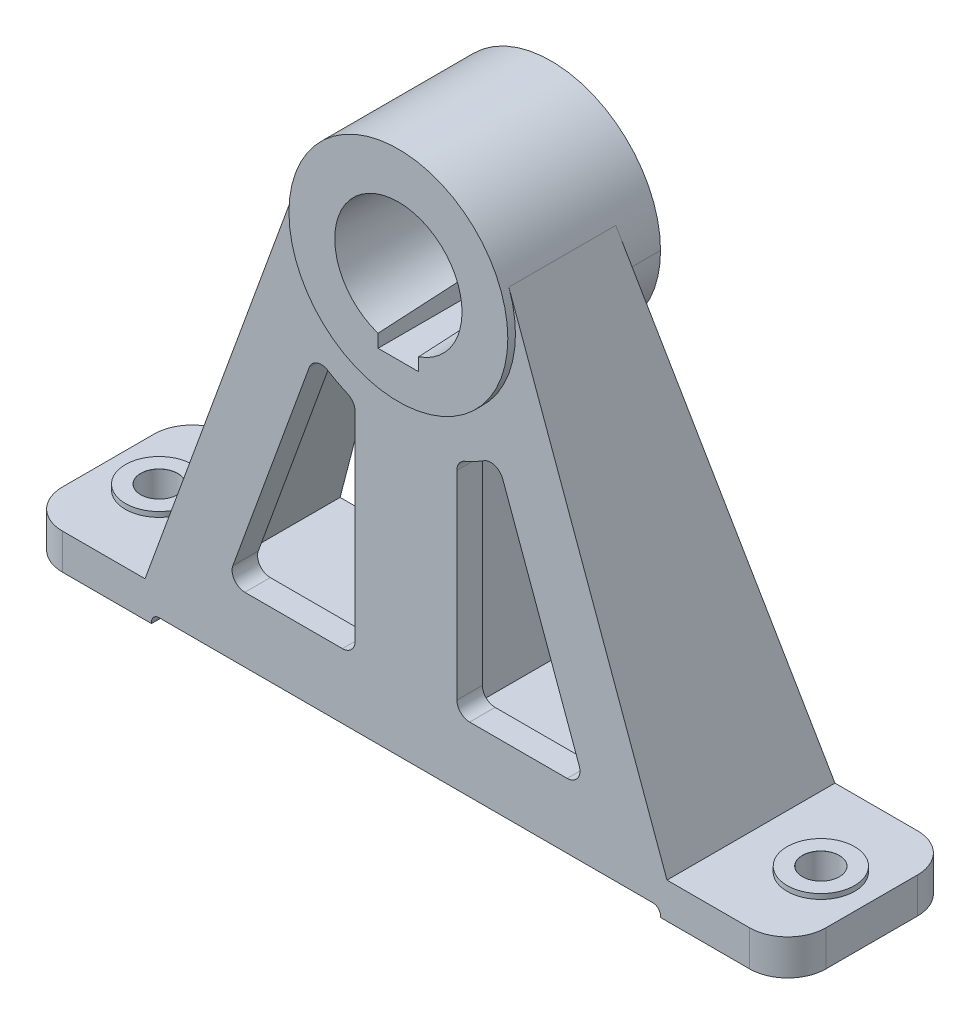
from build123d import *

# Parameters (mm, degrees)
EXTRUDE_1_DEPTH                     = 14
CUT_EXTRUDE_1_DEPTH                 = 165.474922101
CUT_EXTRUDE_1_DEPTH_BACK            = 165.474922101
SKETCH_3_W                          = 200
SKETCH_3_H                          = 3.5
FILLET_1_R                          = 3
EXTRUDE_START                       = 69
SKETCH_7_R                          = 43
EXTRUDE_2_DEPTH                     = 60
EXTRUDE_3_REACH                     = 270.747
CUT_EXTRUDE_START                   = -56
CUT_EXTRUDE_1_2_DEPTH               = 56
RIB_1_REACH                         = 264.992
SKETCH_11_WALL_W                    = 641.342631142
SKETCH_11_WALL_H                    = 10
CUT_EXTRUDE_2_DEPTH                 = 267.467634057
SKETCH_13_R                         = 25
CUT_EXTRUDE_3_DEPTH                 = 270.499536178
CUT_EXTRUDE_3_DRAFT                 = -3
CUT_EXTRUDE_2_2_DEPTH               = 270.499536178
CUT_EXTRUDE_2_2_DEPTH_BACK          = 270.499536178
SKETCH_14_W                         = 16
SKETCH_14_H                         = 28.8
SKETCH_16_R                         = 13.25
EXTRUDE_4_DEPTH                     = 2
HOLE_WIZARD_14_5_14_5_1_D           = 14.5
HOLE_WIZARD_14_5_14_5_1_CSINK_D     = 14.55
HOLE_WIZARD_14_5_14_5_1_CSINK_ANGLE = 90


with BuildPart() as part:
    # 草图2 → 凸台-拉伸1 (new body)
    with BuildSketch(Plane(origin=(0, 0, 0), x_dir=(1, 0, 0), z_dir=(0, 1, 0))):
        with BuildLine():
            Line((-135, -33), (135, -33))
            ThreePointArc((135, -33), (145.606601718, -28.606601718), (150, -18))
            Line((150, -18), (150, 18))
            ThreePointArc((150, 18), (145.606601718, 28.606601718), (135, 33))
            Line((135, 33), (-135, 33))
            ThreePointArc((-135, 33), (-145.606601718, 28.606601718), (-150, 18))
            Line((-150, 18), (-150, -18))
            ThreePointArc((-150, -18), (-145.606601718, -28.606601718), (-135, -33))
        make_face()
    extrude(amount=EXTRUDE_1_DEPTH)

    # 草图3 → Cut-Extrude 1 (cut, two sides: drawn at the far end of the back side and taken through both)
    with BuildSketch(Plane.XY.offset(33).offset(-CUT_EXTRUDE_1_DEPTH_BACK)):
        with Locations((0, 1.75)):
            Rectangle(SKETCH_3_W, SKETCH_3_H)
    extrude(amount=CUT_EXTRUDE_1_DEPTH + CUT_EXTRUDE_1_DEPTH_BACK, mode=Mode.SUBTRACT)

    # 圆角1
    fillet_1_edges = [part.edges().sort_by_distance(p)[0] for p in [
        (-100, 3.5, 0),
        (100, 3.5, 0),
    ]]
    fillet(fillet_1_edges, radius=FILLET_1_R)



with BuildPart() as body_2:
    # 草图7 → 凸台-拉伸2 (new body)
    with BuildSketch(Plane.XY.offset(-33).offset(EXTRUDE_START)):
        with Locations((0, 170)):
            Circle(SKETCH_7_R)
    extrude(amount=-EXTRUDE_2_DEPTH)


with BuildPart() as part_1:
    add(part.part)

    add(body_2.part)  # 凸台-拉伸3 merges body 2
    # 凸台-拉伸3: up to this plane
    extrude_3_end = Plane(origin=(0, 14, -33), z_dir=(0, 0.13917310096005872, -0.9902680687415714))
    # 草图9 → 凸台-拉伸3 (add, up to the surface)
    with BuildSketch(Plane.XY.offset(33), mode=Mode.PRIVATE) as extrude_3_sk1:
        with BuildLine():
            Line((-102.539000762, 14), (-40.406782694, 184.706866163))
            ThreePointArc((-40.406782694, 184.706866163), (0, 127), (40.406782694, 184.706866163))
            Line((40.406782694, 184.706866163), (102.539000762, 14))
            Line((102.539000762, 14), (-102.539000762, 14))
        make_face()
    extrude_3_tool1 = split(extrude(extrude_3_sk1.sketch, amount=-EXTRUDE_3_REACH, mode=Mode.PRIVATE), bisect_by=extrude_3_end, keep=Keep.BOTH, mode=Mode.PRIVATE)
    add(extrude_3_tool1.solids().sort_by_distance((0, 72.176289, 33))[0])

    # 草图10 → Cut-Extrude 1 2 (cut)
    with BuildSketch(Plane(origin=(0, 0, -33), x_dir=(-1, 0, 0), z_dir=(0, 0, -1)).offset(CUT_EXTRUDE_START)):
        with BuildLine():
            Line((91.897223037, 14), (-91.897223037, 14))
            Line((-91.897223037, 14), (-40.438701146, 155.381126936))
            ThreePointArc((-40.438701146, 155.381126936), (0, 127), (40.438701146, 155.381126936))
            Line((40.438701146, 155.381126936), (91.897223037, 14))
        make_face()
    extrude(amount=CUT_EXTRUDE_1_2_DEPTH, mode=Mode.SUBTRACT)

    # 草图11 wall → 筋1 (add, up to next)
    with BuildSketch(Plane(origin=(0, 70.5, -28.5), x_dir=(0, -0.996843266544, -0.07939459645), z_dir=(0, 0.07939459645, -0.996843266544)), mode=Mode.PRIVATE) as rib_1_sk1:
        Rectangle(SKETCH_11_WALL_W, SKETCH_11_WALL_H)
    rib_1_tool1 = extrude(rib_1_sk1.sketch, amount=-RIB_1_REACH, mode=Mode.PRIVATE) - part_1.part
    add(rib_1_tool1.solids().sort_by_distance((0, 70.5, -28.5))[0])

    # 草图12 → Cut-Extrude 2 (cut, through all)
    with BuildSketch(Plane(origin=(0, 0, 23), x_dir=(-1, 0, 0), z_dir=(0, 0, -1))):
        with BuildLine():
            Line((20, 112.172670821), (20, 34))
            ThreePointArc((20, 34), (21.464466094, 30.464466094), (25, 29))
            Line((25, 29), (63.334262902, 29))
            ThreePointArc((63.334262902, 29), (67.430023124, 31.132117818), (68.032726006, 35.710100717))
            Line((68.032726006, 35.710100717), (37.998004782, 118.229819079))
            ThreePointArc((37.998004782, 118.229819079), (34.9311572, 121.246009804), (30.65672091, 120.764185159))
            ThreePointArc((30.65672091, 120.764185159), (26.910795664, 118.620927638), (23.015873016, 116.762141391))
            ThreePointArc((23.015873016, 116.762141391), (20.82144553, 114.918519058), (20, 112.172670821))
        make_face()
    cut_extrude_2 = extrude(amount=-CUT_EXTRUDE_2_DEPTH, mode=Mode.SUBTRACT)

    # 镜向1: Cut-Extrude 2 across plane
    add(cut_extrude_2.mirror(Plane(origin=(0, 0, 0), x_dir=(0, 0, 1), z_dir=(1, 0, 0))), mode=Mode.SUBTRACT)


with BuildPart() as cut_extrude_3_tool:
    # 草图13 → 切除-拉伸3 (with draft: the straight prism first)
    with BuildSketch(Plane.XY.offset(36)):
        with Locations((0, 170)):
            Circle(SKETCH_13_R)
    extrude(amount=-CUT_EXTRUDE_3_DEPTH)
    # 切除-拉伸3: the draft: its side faces are tilted about the plane it starts from
    cut_extrude_3_sides = [cut_extrude_3_tool.faces().sort_by_distance(p)[0] for p in [
        (-25, 170, -99.249768089),
    ]]
    draft(cut_extrude_3_sides, Plane.XY.offset(36), CUT_EXTRUDE_3_DRAFT)


with BuildPart() as part_2:
    add(part_1.part)

    # 切除-拉伸3: cut by cut_extrude_3_tool
    add(cut_extrude_3_tool.part, mode=Mode.SUBTRACT)

    # 草图14 → Cut-Extrude 2 2 (cut, two sides: drawn at the far end of the back side and taken through both)
    with BuildSketch(Plane.XY.offset(36).offset(-CUT_EXTRUDE_2_2_DEPTH_BACK)):
        with Locations((0, 155.6)):
            Rectangle(SKETCH_14_W, SKETCH_14_H)
    extrude(amount=CUT_EXTRUDE_2_2_DEPTH + CUT_EXTRUDE_2_2_DEPTH_BACK, mode=Mode.SUBTRACT)

    # 草图16 → 凸台-拉伸4 (add)
    with BuildSketch(Plane(origin=(0, 14, 0), x_dir=(1, 0, 0), z_dir=(0, 1, 0))):
        with Locations(Location((130, 0, 0), (0, 0, 270))):
            Circle(SKETCH_16_R)
    extrude_4 = extrude(amount=EXTRUDE_4_DEPTH)

    # Ø14.5 (14.5) 直径孔1 (through all)
    with Locations(Plane(origin=(0, 16, 0), x_dir=(1, 0, 0), z_dir=(0, 1, 0))):
        with Locations((130, 0)):
            hole_wizard_14_5_14_5_1 = CounterSinkHole(HOLE_WIZARD_14_5_14_5_1_D / 2, HOLE_WIZARD_14_5_14_5_1_CSINK_D / 2, counter_sink_angle=HOLE_WIZARD_14_5_14_5_1_CSINK_ANGLE)

    # 镜向2: 凸台-拉伸4, Ø14.5 (14.5) 直径孔1 across plane
    add(extrude_4.mirror(Plane(origin=(0, 0, 0), x_dir=(0, 0, 1), z_dir=(1, 0, 0))))
    add(hole_wizard_14_5_14_5_1.mirror(Plane(origin=(0, 0, 0), x_dir=(0, 0, 1), z_dir=(1, 0, 0))), mode=Mode.SUBTRACT)


solid = part_2.part
